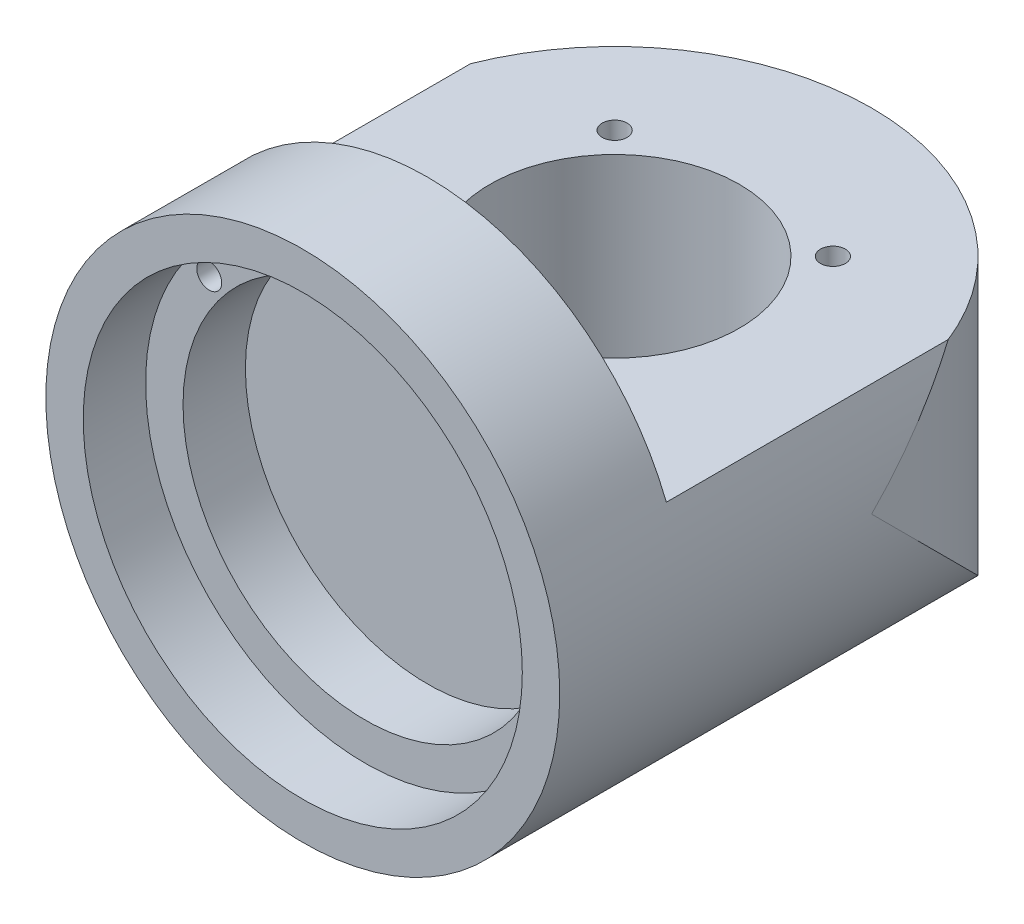
from build123d import *

# Parameters (mm, degrees)
SKETCH_1_R           = 41.2
EXTRUDE_1_DEPTH      = 20
EXTRUDE_3_DEPTH      = 15.2
EXTRUDE_3_DEPTH_BACK = 32.2
SKETCH_2_W           = 82.4
SKETCH_2_H           = 30
SKETCH_3_OUTSIDE_W   = 113.996
SKETCH_3_OUTSIDE_H   = 113.996
SKETCH_3_OUTSIDE_R   = 41.2
CUT_EXTRUDE_1_DEPTH  = 70.2
SKETCH_4_R           = 20
CUT_EXTRUDE_2_DEPTH  = 43.8
SKETCH_5_R           = 15.7
CUT_EXTRUDE_3_DEPTH  = 3.6
SKETCH_9_R           = 35.2
CUT_EXTRUDE_6_DEPTH  = 10
SKETCH_10_R          = 29.2
CUT_EXTRUDE_7_DEPTH  = 10
SKETCH_12_R          = 2
CUT_EXTRUDE_8_DEPTH  = 10
SKETCH_13_R          = 2
CUT_EXTRUDE_9_DEPTH  = 2.1
SKETCH_15_R          = 0.8
CUT_EXTRUDE_10_DEPTH = 1.5
SKETCH_16_R          = 2
CUT_EXTRUDE_13_DEPTH = 40


with BuildPart() as part:
    # 草图1 → 凸台-拉伸1 (new body)
    with BuildSketch(Plane.XY):
        Circle(SKETCH_1_R)
    extrude(amount=EXTRUDE_1_DEPTH)

    # 草图2 → 凸台-拉伸3 (add, two sides: drawn at the far end of the back side and taken through both)
    with BuildSketch(Plane(origin=(0, 0, 0), x_dir=(1, 0, 0), z_dir=(0, 1, 0)).offset(-EXTRUDE_3_DEPTH_BACK)):
        with Locations((0, 15)):
            Rectangle(SKETCH_2_W, SKETCH_2_H)
        with BuildLine():
            Line((-41.2, 30), (41.2, 30))
            ThreePointArc((41.2, 30), (0, 71.2), (-41.2, 30))
        make_face()
    extrude(amount=EXTRUDE_3_DEPTH + EXTRUDE_3_DEPTH_BACK)

    # 草图3 outside → 切除-拉伸1 (cut)
    with BuildSketch(Plane(origin=(0, 0, 0), x_dir=(-1, 0, 0), z_dir=(0, 0, -1))):
        Rectangle(SKETCH_3_OUTSIDE_W, SKETCH_3_OUTSIDE_H)
        with Locations(Location((0, 0, 0), (0, 0, 180))):
            Circle(SKETCH_3_OUTSIDE_R, mode=Mode.SUBTRACT)
    extrude(amount=CUT_EXTRUDE_1_DEPTH, mode=Mode.SUBTRACT)

    # 草图4 → 切除-拉伸2 (cut)
    with BuildSketch(Plane(origin=(0, 15.2, 0), x_dir=(1, 0, 0), z_dir=(0, 1, 0))):
        with Locations(Location((0, 30, 0), (0, 0, 270))):
            Circle(SKETCH_4_R)
    extrude(amount=-CUT_EXTRUDE_2_DEPTH, mode=Mode.SUBTRACT)

    # 草图5 → 切除-拉伸3 (cut)
    with BuildSketch(Plane(origin=(0, -28.6, 0), x_dir=(1, 0, 0), z_dir=(0, 1, 0))):
        with Locations(Location((0, 30, 0), (0, 0, 270))):
            Circle(SKETCH_5_R)
    extrude(amount=-CUT_EXTRUDE_3_DEPTH, mode=Mode.SUBTRACT)

    # 草图9 → 切除-拉伸6 (cut)
    with BuildSketch(Plane.XY.offset(20)):
        Circle(SKETCH_9_R)
    extrude(amount=-CUT_EXTRUDE_6_DEPTH, mode=Mode.SUBTRACT)

    # 草图10 → 切除-拉伸7 (cut)
    with BuildSketch(Plane.XY.offset(10)):
        Circle(SKETCH_10_R)
    extrude(amount=-CUT_EXTRUDE_7_DEPTH, mode=Mode.SUBTRACT)

    # 草图12 → 切除-拉伸8 (cut)
    with BuildSketch(Plane.XY):
        with Locations((-25, 20)):
            Circle(SKETCH_12_R)
        with Locations((-17, 28)):
            Circle(SKETCH_12_R)
        with Locations((25, 20)):
            Circle(SKETCH_12_R)
        with Locations((17, 28)):
            Circle(SKETCH_12_R)
    extrude(amount=CUT_EXTRUDE_8_DEPTH, mode=Mode.SUBTRACT)

    # 草图13 → 切除-拉伸9 (cut)
    with BuildSketch(Plane.XZ.offset(32.2)):
        with Locations(Location((0, -48, 0), (0, 0, 270))):
            Circle(SKETCH_13_R)
        with Locations(Location((-12.727922061, -42.727922061, 0), (0, 0, 270))):
            Circle(SKETCH_13_R)
        with Locations(Location((-18, -30, 0), (0, 0, 270))):
            Circle(SKETCH_13_R)
        with Locations(Location((-12.727922061, -17.272077939, 0), (0, 0, 270))):
            Circle(SKETCH_13_R)
        with Locations(Location((0, -12, 0), (0, 0, 270))):
            Circle(SKETCH_13_R)
        with Locations(Location((12.727922061, -17.272077939, 0), (0, 0, 270))):
            Circle(SKETCH_13_R)
        with Locations(Location((18, -30, 0), (0, 0, 270))):
            Circle(SKETCH_13_R)
        with Locations(Location((12.727922061, -42.727922061, 0), (0, 0, 270))):
            Circle(SKETCH_13_R)
    extrude(amount=-CUT_EXTRUDE_9_DEPTH, mode=Mode.SUBTRACT)

    # 草图15 → 切除-拉伸10 (cut)
    with BuildSketch(Plane(origin=(0, -30.1, 0), x_dir=(-1, 0, 0), z_dir=(0, -1, 0))):
        with Locations(Location((0, 48, 0), (0, 0, 90))):
            Circle(SKETCH_15_R)
        with Locations(Location((12.727922061, 42.727922061, 0), (0, 0, 90))):
            Circle(SKETCH_15_R)
        with Locations(Location((18, 30, 0), (0, 0, 90))):
            Circle(SKETCH_15_R)
        with Locations(Location((12.727922061, 17.272077939, 0), (0, 0, 90))):
            Circle(SKETCH_15_R)
        with Locations(Location((0, 12, 0), (0, 0, 90))):
            Circle(SKETCH_15_R)
        with Locations(Location((-12.727922061, 17.272077939, 0), (0, 0, 90))):
            Circle(SKETCH_15_R)
        with Locations(Location((-18, 30, 0), (0, 0, 90))):
            Circle(SKETCH_15_R)
        with Locations(Location((-12.727922061, 42.727922061, 0), (0, 0, 90))):
            Circle(SKETCH_15_R)
    extrude(amount=-CUT_EXTRUDE_10_DEPTH, mode=Mode.SUBTRACT)

    # 草图16 → 切除-拉伸13 (cut)
    with BuildSketch(Plane(origin=(0, 15.2, 0), x_dir=(1, 0, 0), z_dir=(0, 1, 0))):
        with Locations(Location((-17.5, 47.5, 0), (0, 0, 270))):
            Circle(SKETCH_16_R)
        with Locations(Location((17.5, 47.5, 0), (0, 0, 270))):
            Circle(SKETCH_16_R)
    extrude(amount=-CUT_EXTRUDE_13_DEPTH, mode=Mode.SUBTRACT)


solid = part.part
